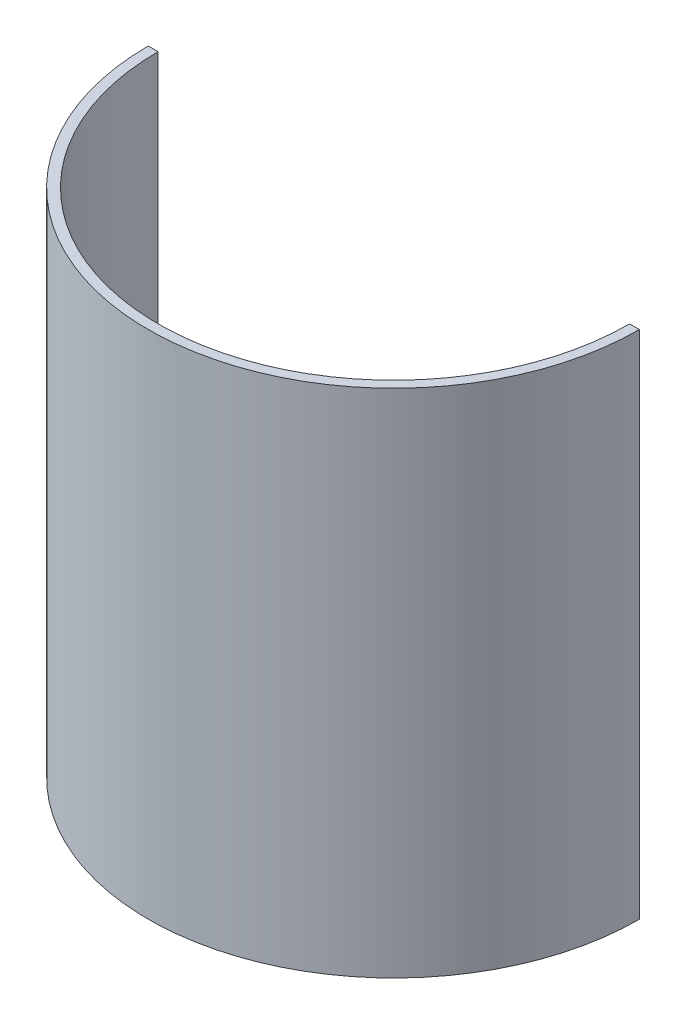
from build123d import *

# Parameters (mm, degrees)
BOSS_EXTRUDE1_DEPTH = 26


with BuildPart() as part:
    # Sketch1 → Boss-Extrude1 (new body)
    with BuildSketch(Plane(origin=(0, 0, 0), x_dir=(1, 0, 0), z_dir=(0, 1, 0))):
        with BuildLine():
            Line((-12.5, 0), (-12, 0))
            ThreePointArc((-12, 0), (0, -12), (12, 0))
            Line((12, 0), (12.5, 0))
            ThreePointArc((12.5, 0), (0, -12.5), (-12.5, 0))
        make_face()
    extrude(amount=BOSS_EXTRUDE1_DEPTH)


solid = part.part
